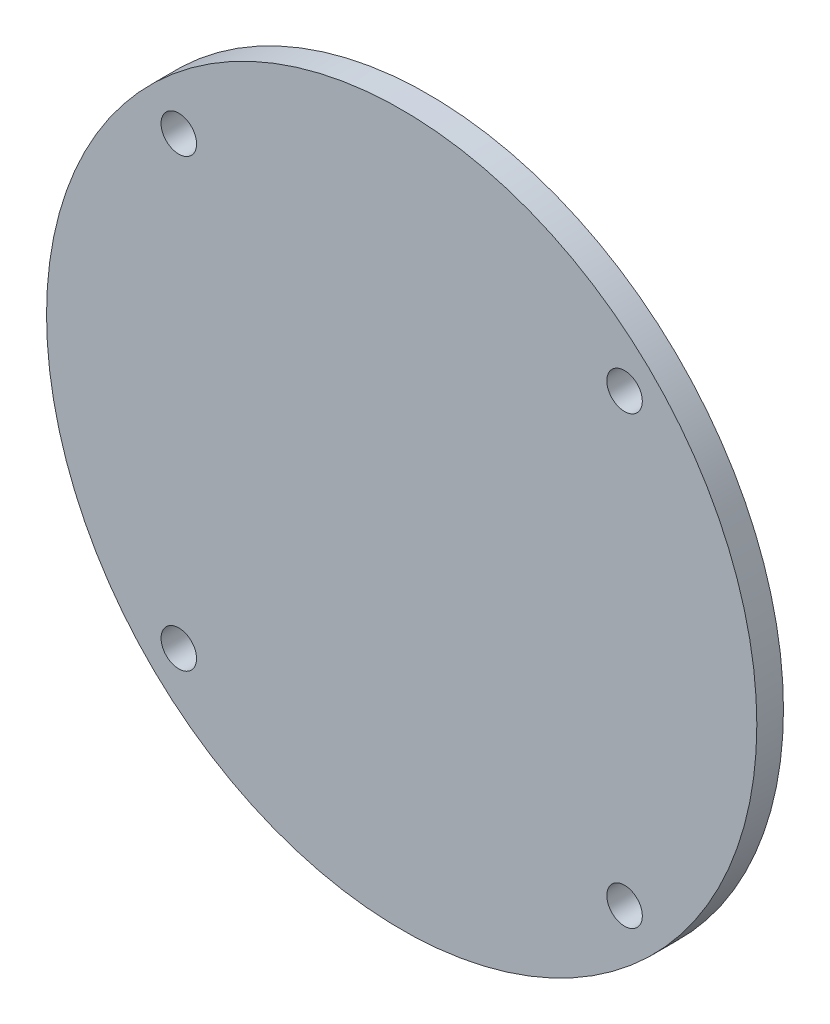
from build123d import *

# Parameters (mm, degrees)
SKETCH_1_R      = 40
SKETCH_1_R_2    = 2
EXTRUDE_1_DEPTH = 3


with BuildPart() as part:
    # 草图1 → 凸台-拉伸1 (new body)
    with BuildSketch(Plane.XY):
        Circle(SKETCH_1_R)
        with Locations((-25.102290732, 25.102290732)):
            Circle(SKETCH_1_R_2, mode=Mode.SUBTRACT)
        with Locations((25.102290732, 25.102290732)):
            Circle(SKETCH_1_R_2, mode=Mode.SUBTRACT)
        with Locations((25.102290732, -25.102290732)):
            Circle(SKETCH_1_R_2, mode=Mode.SUBTRACT)
        with Locations((-25.102290732, -25.102290732)):
            Circle(SKETCH_1_R_2, mode=Mode.SUBTRACT)
    extrude(amount=EXTRUDE_1_DEPTH)


solid = part.part
